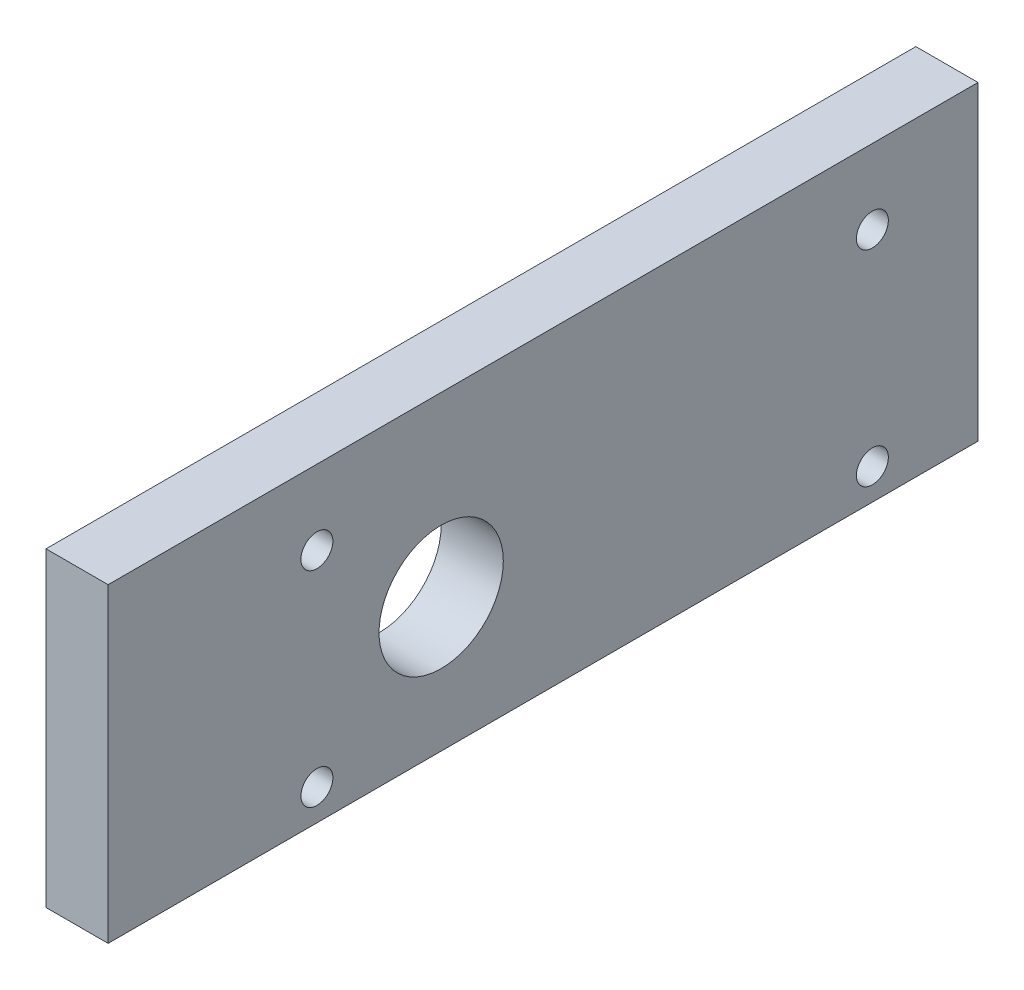
from build123d import *

# Parameters (mm, degrees)
SKETCH1_W           = 88.9
SKETCH1_H           = 31.75
BOSS_EXTRUDE1_DEPTH = 3.175
CUT_EXTRUDE1_REACH  = 49.625
SKETCH2_R           = 1.63195
SKETCH2_R_2         = 6.35


with BuildPart() as part:
    # Sketch1 → Boss-Extrude1 (new, symmetric)
    with BuildSketch(Plane(origin=(0, 0, 0), x_dir=(0, 0, -1), z_dir=(1, 0, 0))):
        Rectangle(SKETCH1_W, SKETCH1_H)
    extrude(amount=BOSS_EXTRUDE1_DEPTH, both=True)

    # Sketch2 → Cut-Extrude1 (cut, up to next)
    with BuildSketch(Plane(origin=(3.175, 0, 0), x_dir=(0, 0, -1), z_dir=(1, 0, 0)), mode=Mode.PRIVATE) as cut_extrude1_sk1:
        with Locations((-23.114, 8.255)):
            Circle(SKETCH2_R)
    cut_extrude1_tool1 = extrude(cut_extrude1_sk1.sketch, amount=-CUT_EXTRUDE1_REACH, mode=Mode.PRIVATE) & part.part
    # Sketch2 → Cut-Extrude1 (cut, up to next)
    with BuildSketch(Plane(origin=(3.175, 0, 0), x_dir=(0, 0, -1), z_dir=(1, 0, 0)), mode=Mode.PRIVATE) as cut_extrude1_sk2:
        with Locations((-23.114, -12.7)):
            Circle(SKETCH2_R)
    cut_extrude1_tool2 = extrude(cut_extrude1_sk2.sketch, amount=-CUT_EXTRUDE1_REACH, mode=Mode.PRIVATE) & part.part
    # Sketch2 → Cut-Extrude1 (cut, up to next)
    with BuildSketch(Plane(origin=(3.175, 0, 0), x_dir=(0, 0, -1), z_dir=(1, 0, 0)), mode=Mode.PRIVATE) as cut_extrude1_sk3:
        with Locations((33.655, -12.7)):
            Circle(SKETCH2_R)
    cut_extrude1_tool3 = extrude(cut_extrude1_sk3.sketch, amount=-CUT_EXTRUDE1_REACH, mode=Mode.PRIVATE) & part.part
    # Sketch2 → Cut-Extrude1 (cut, up to next)
    with BuildSketch(Plane(origin=(3.175, 0, 0), x_dir=(0, 0, -1), z_dir=(1, 0, 0)), mode=Mode.PRIVATE) as cut_extrude1_sk4:
        with Locations((33.655, 8.255)):
            Circle(SKETCH2_R)
    cut_extrude1_tool4 = extrude(cut_extrude1_sk4.sketch, amount=-CUT_EXTRUDE1_REACH, mode=Mode.PRIVATE) & part.part
    # Sketch2 → Cut-Extrude1 (cut, up to next)
    with BuildSketch(Plane(origin=(3.175, 0, 0), x_dir=(0, 0, -1), z_dir=(1, 0, 0)), mode=Mode.PRIVATE) as cut_extrude1_sk5:
        with Locations((-10.414, -2.2225)):
            Circle(SKETCH2_R_2)
    cut_extrude1_tool5 = extrude(cut_extrude1_sk5.sketch, amount=-CUT_EXTRUDE1_REACH, mode=Mode.PRIVATE) & part.part
    add(cut_extrude1_tool1.solids().sort_by_distance((3.175, 8.255, 23.114))[0], mode=Mode.SUBTRACT)
    add(cut_extrude1_tool2.solids().sort_by_distance((3.175, -12.7, 23.114))[0], mode=Mode.SUBTRACT)
    add(cut_extrude1_tool3.solids().sort_by_distance((3.175, -12.7, -33.655))[0], mode=Mode.SUBTRACT)
    add(cut_extrude1_tool4.solids().sort_by_distance((3.175, 8.255, -33.655))[0], mode=Mode.SUBTRACT)
    add(cut_extrude1_tool5.solids().sort_by_distance((3.175, -2.2225, 10.414))[0], mode=Mode.SUBTRACT)


solid = part.part
